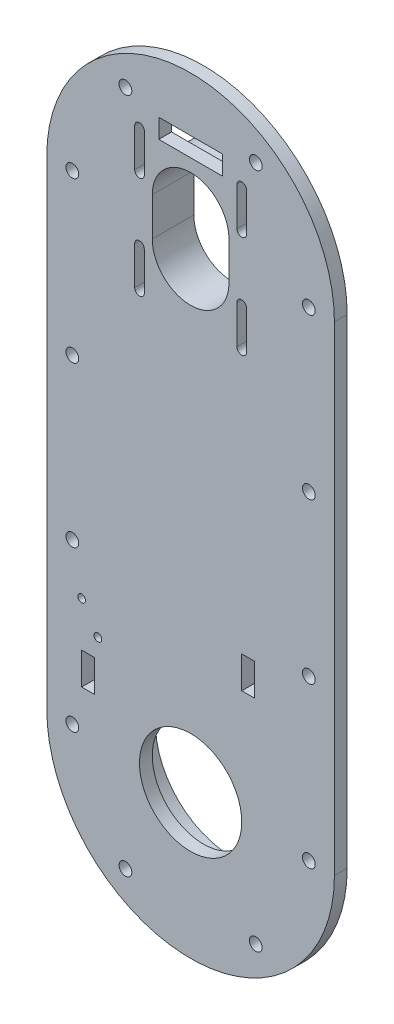
from build123d import *

# Parameters (mm, degrees)
ESBO_O1_R                = 16
RESSALTO_EXTRUS_O1_DEPTH = 4
ESBO_O2_R                = 27
ESBO_O2_R_2              = 24
RESSALTO_EXTRUS_O2_DEPTH = 9
ESBO_O4_R                = 2
CORTE_EXTRUS_O1_DEPTH    = 4
RESSALTO_EXTRUS_O3_START = 9
RESSALTO_EXTRUS_O3_DEPTH = 9
NERVURA4_REACH           = 202.547
ESBO_O8_WALLS_W          = 5
ESBO_O8_WALLS_H          = 505.093505308
ESBO_O9_R                = 1.2
ESBO_O9_W                = 4
ESBO_O9_H                = 10
ESBO_O9_W_2              = 20
ESBO_O9_H_2              = 6
CORTE_EXTRUS_O2_DEPTH    = 4


with BuildPart() as part:
    # Esboço1 → Ressalto-extrusão1 (new body)
    with BuildSketch(Plane.XY):
        with BuildLine():
            Line((45, 0), (45, 150))
            ThreePointArc((45, 150), (0, 195), (-45, 150))
            Line((-45, 150), (-45, 0))
            ThreePointArc((-45, 0), (0, -45), (45, 0))
        make_face()
        Circle(ESBO_O1_R, mode=Mode.SUBTRACT)
        with BuildLine():
            Line((12, 156), (12, 144))
            ThreePointArc((12, 144), (0, 132), (-12, 144))
            Line((-12, 144), (-12, 156))
            ThreePointArc((-12, 156), (0, 168), (12, 156))
        make_face(mode=Mode.SUBTRACT)
        with BuildLine():
            Line((14.49, 159.99), (14.49, 171.99))
            ThreePointArc((14.49, 171.99), (15.99, 173.49), (17.49, 171.99))
            Line((17.49, 171.99), (17.49, 159.99))
            ThreePointArc((17.49, 159.99), (15.99, 158.49), (14.49, 159.99))
        make_face(mode=Mode.SUBTRACT)
        with BuildLine():
            Line((-17.49, 159.99), (-17.49, 171.99))
            ThreePointArc((-17.49, 171.99), (-15.99, 173.49), (-14.49, 171.99))
            Line((-14.49, 171.99), (-14.49, 159.99))
            ThreePointArc((-14.49, 159.99), (-15.99, 158.49), (-17.49, 159.99))
        make_face(mode=Mode.SUBTRACT)
        with BuildLine():
            Line((14.49, 128.01), (14.49, 140.01))
            ThreePointArc((14.49, 140.01), (15.99, 141.51), (17.49, 140.01))
            Line((17.49, 140.01), (17.49, 128.01))
            ThreePointArc((17.49, 128.01), (15.99, 126.51), (14.49, 128.01))
        make_face(mode=Mode.SUBTRACT)
        with BuildLine():
            Line((-17.49, 128.01), (-17.49, 140.01))
            ThreePointArc((-17.49, 140.01), (-15.99, 141.51), (-14.49, 140.01))
            Line((-14.49, 140.01), (-14.49, 128.01))
            ThreePointArc((-14.49, 128.01), (-15.99, 126.51), (-17.49, 128.01))
        make_face(mode=Mode.SUBTRACT)
    extrude(amount=RESSALTO_EXTRUS_O1_DEPTH)

    # Esboço2 → Ressalto-extrusão2 (add)
    with BuildSketch(Plane.XY):
        Circle(ESBO_O2_R)
        Circle(ESBO_O2_R_2, mode=Mode.SUBTRACT)
    extrude(amount=-RESSALTO_EXTRUS_O2_DEPTH)

    # Esboço4 → Corte-extrusão1 (cut)
    with BuildSketch(Plane.XY.offset(4)):
        with Locations((-37, 150)):
            Circle(ESBO_O4_R)
        with Locations((-37, 100)):
            Circle(ESBO_O4_R)
        with Locations((-37, 50)):
            Circle(ESBO_O4_R)
        with Locations((-37, 0)):
            Circle(ESBO_O4_R)
        with Locations((-20.397134603, 180.87)):
            Circle(ESBO_O4_R)
        with Locations((-20.397134603, -30.87)):
            Circle(ESBO_O4_R)
        with Locations((20.397134603, -30.87)):
            Circle(ESBO_O4_R)
        with Locations((20.397134603, 180.87)):
            Circle(ESBO_O4_R)
        with Locations((37, 0)):
            Circle(ESBO_O4_R)
        with Locations((37, 50)):
            Circle(ESBO_O4_R)
        with Locations((37, 100)):
            Circle(ESBO_O4_R)
        with Locations((37, 150)):
            Circle(ESBO_O4_R)
    extrude(amount=-CORTE_EXTRUS_O1_DEPTH, mode=Mode.SUBTRACT)

    # Esboço6 → Ressalto-extrusão3 (add)
    with BuildSketch(Plane(origin=(0, 0, 0), x_dir=(-1, 0, 0), z_dir=(0, 0, -1)).offset(RESSALTO_EXTRUS_O3_START)):
        with BuildLine():
            Line((-14, 143), (-14, 157))
            ThreePointArc((-14, 157), (0, 171), (14, 157))
            Line((14, 157), (14, 143))
            ThreePointArc((14, 143), (0, 129), (-14, 143))
        make_face()
        with BuildLine():
            Line((-12, 144), (-12, 156))
            ThreePointArc((-12, 156), (0, 168), (12, 156))
            Line((12, 156), (12, 144))
            ThreePointArc((12, 144), (0, 132), (-12, 144))
        make_face(mode=Mode.SUBTRACT)
    extrude(amount=-RESSALTO_EXTRUS_O3_DEPTH)

    # Esboço8 walls → Nervura4 (add, up to next)
    with BuildSketch(Plane(origin=(0, 0, -9), x_dir=(-1, 0, 0), z_dir=(0, 0, -1)), mode=Mode.PRIVATE) as nervura4_sk1:
        with Locations((0, 78)):
            Rectangle(ESBO_O8_WALLS_W, ESBO_O8_WALLS_H)
    nervura4_tool1 = extrude(nervura4_sk1.sketch, amount=-NERVURA4_REACH, mode=Mode.PRIVATE) - part.part
    add(nervura4_tool1.solids().sort_by_distance((0, 78, -9))[0])

    # Esboço9 → Corte-extrusão2 (cut)
    with BuildSketch(Plane(origin=(0, 0, 0), x_dir=(-1, 0, 0), z_dir=(0, 0, -1))):
        with Locations((29.032258065, 27.515958854)):
            Circle(ESBO_O9_R)
        with Locations((34.10505047, 35.548192492)):
            Circle(ESBO_O9_R)
        with Locations((32.10505047, 16.515958854)):
            Rectangle(ESBO_O9_W, ESBO_O9_H)
        with Locations((-0.034362558, 175)):
            Rectangle(ESBO_O9_W_2, ESBO_O9_H_2)
        with Locations((-18, 40.548192492)):
            Rectangle(ESBO_O9_W, ESBO_O9_H)
    extrude(amount=-CORTE_EXTRUS_O2_DEPTH, mode=Mode.SUBTRACT)


solid = part.part
